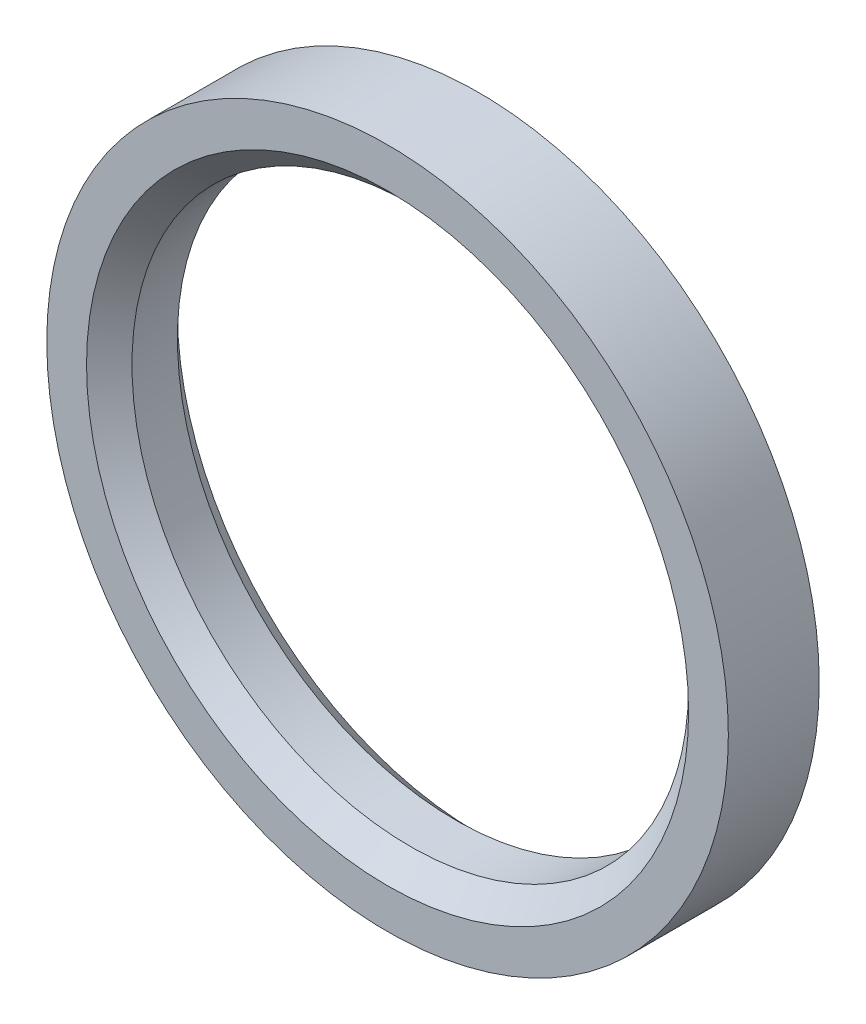
from build123d import *

# Parameters (mm, degrees)
SKETCH_1_R      = 15
SKETCH_1_R_2    = 12.25
EXTRUDE_1_DEPTH = 4
CHAMFER_1_SIZE  = 1


with BuildPart() as part:
    # 草图1 → 凸台-拉伸1 (new body)
    with BuildSketch(Plane.XY):
        Circle(SKETCH_1_R)
        Circle(SKETCH_1_R_2, mode=Mode.SUBTRACT)
    extrude(amount=EXTRUDE_1_DEPTH)

    # 倒角1
    chamfer_1_edges = [part.edges().sort_by_distance(p)[0] for p in [
        (-12.25, 0, 0),
        (-12.25, 0, 4),
    ]]
    chamfer(chamfer_1_edges, length=CHAMFER_1_SIZE)


solid = part.part
